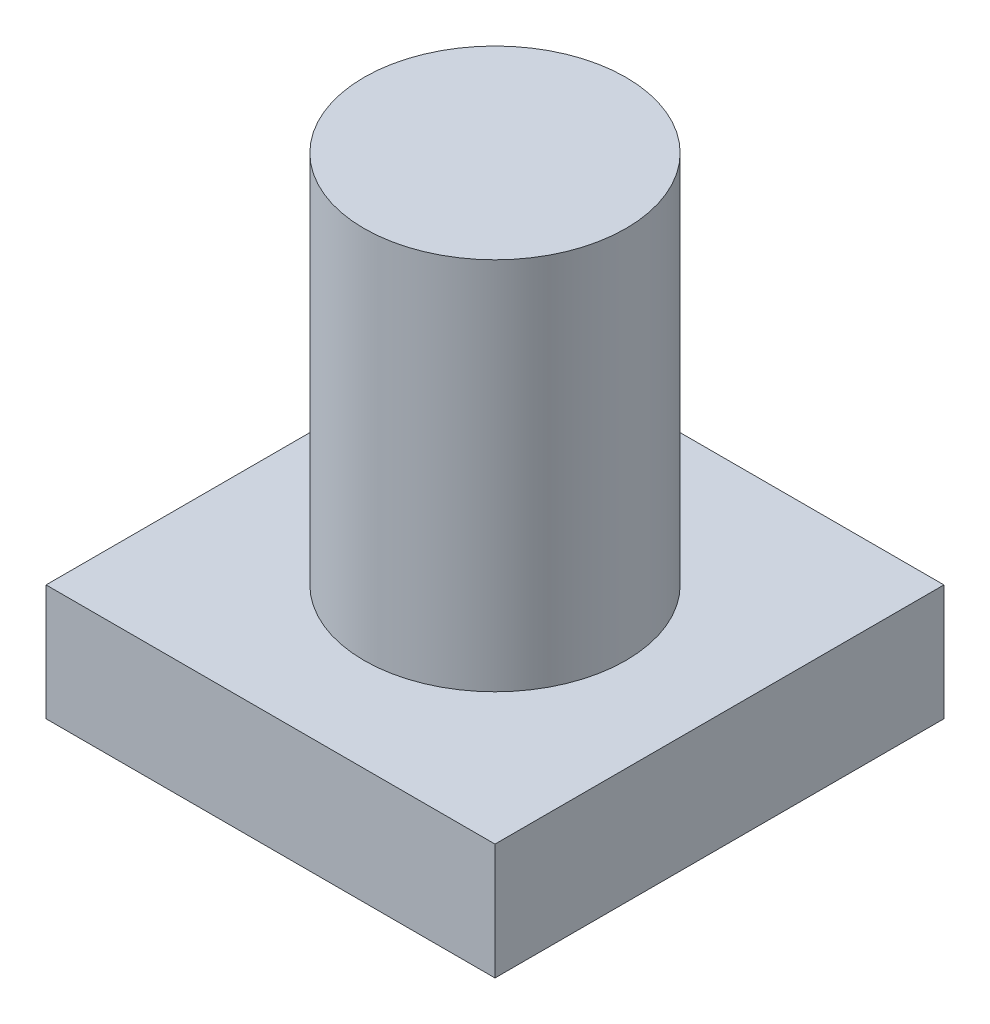
from build123d import *

# Parameters (mm, degrees)
SKETCH_1_W      = 12
SKETCH_1_H      = 12
EXTRUDE_1_DEPTH = 3.1
SKETCH_2_R      = 3.5
EXTRUDE_2_DEPTH = 10


with BuildPart() as part:
    # 草图1 → 拉伸1 (new body)
    with BuildSketch(Plane(origin=(0, 0, 0), x_dir=(1, 0, 0), z_dir=(0, 1, 0))):
        Rectangle(SKETCH_1_W, SKETCH_1_H)
    extrude(amount=EXTRUDE_1_DEPTH)

    # 草图2 → 拉伸2 (add)
    with BuildSketch(Plane(origin=(0, 3.1, 0), x_dir=(-1, 0, 0), z_dir=(0, 1, 0))):
        with Locations(Location((0, 0, 0), (0, 0, 90))):
            Circle(SKETCH_2_R)
    extrude(amount=EXTRUDE_2_DEPTH)


solid = part.part
